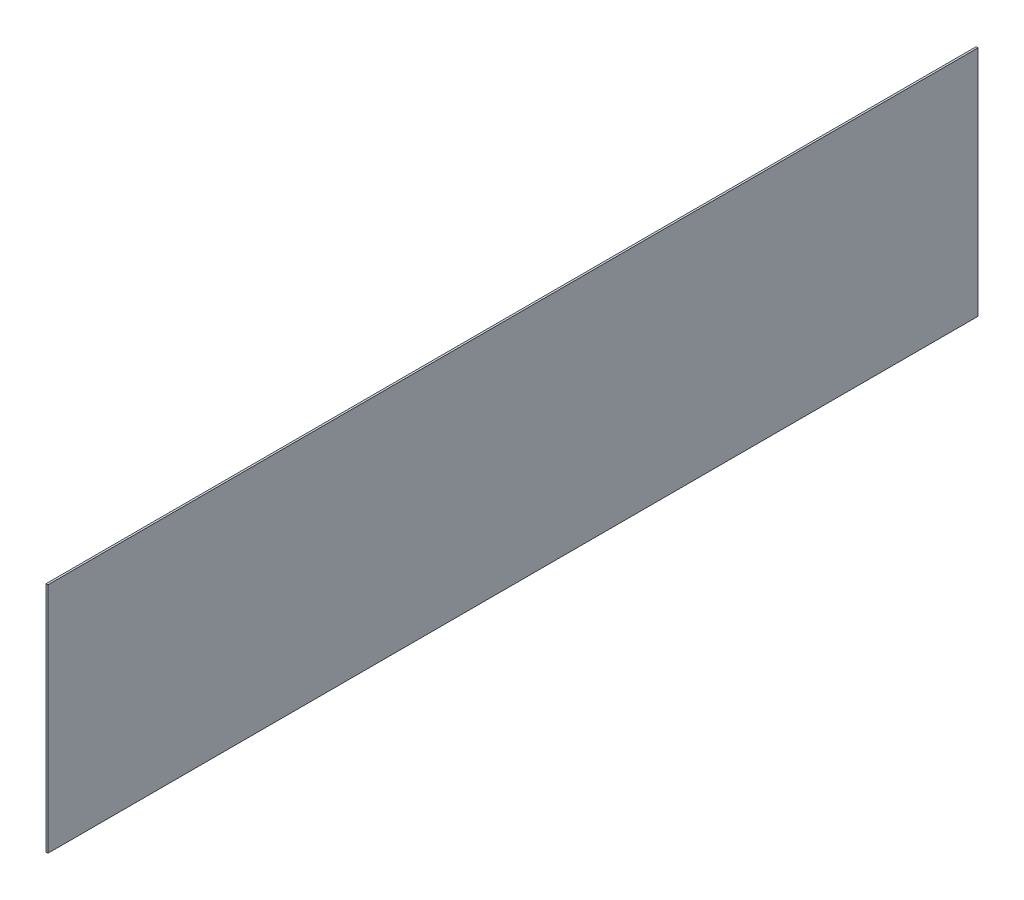
from build123d import *

# Parameters (mm, degrees)
SKETCH1_W           = 304.8
SKETCH1_H           = 76.2
BOSS_EXTRUDE1_DEPTH = 0.3175


with BuildPart() as part:
    # Sketch1 → Boss-Extrude1 (new, symmetric)
    with BuildSketch(Plane(origin=(0, 0, 0), x_dir=(0, 0, -1), z_dir=(1, 0, 0))):
        with Locations((0, 38.1)):
            Rectangle(SKETCH1_W, SKETCH1_H)
    extrude(amount=BOSS_EXTRUDE1_DEPTH, both=True)


solid = part.part
